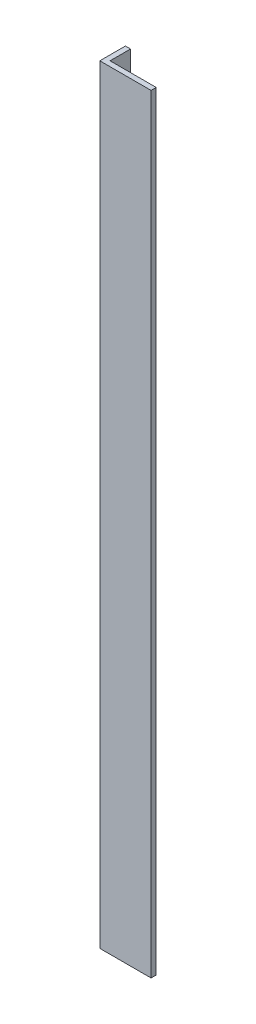
from build123d import *

# Parameters (mm, degrees)
BOSS_EXTRUDE1_DEPTH               = 300
F_3_0MM_DOWEL_HOLE1_D             = 3
F_3_0MM_DOWEL_HOLE2_D             = 3
SKETCH9_W                         = 1.5
SKETCH9_H                         = 1.999985051
F_3_0_3_DIAMETER_HOLE1_AT_2_COUNT = 2
F_3_0_3_DIAMETER_HOLE1_AT_2_PITCH = 24


with BuildPart() as part:
    # Sketch1 → Boss-Extrude1 (new body)
    with BuildSketch(Plane(origin=(0, 0, 0), x_dir=(1, 0, 0), z_dir=(0, 1, 0))):
        Polygon((0, 0), (0, 10), (2, 10), (2, 2), (20, 2), (20, 0), align=None)
    extrude(amount=BOSS_EXTRUDE1_DEPTH)

    # Ø3.0mm Dowel Hole1 (through all)
    with Locations(Plane.ZY):
        with Locations((-7.25, 2.75)):
            Hole(F_3_0MM_DOWEL_HOLE1_D / 2)

    # Ø3.0mm Dowel Hole2 (through all)
    with Locations(Plane.ZY):
        with Locations((-7.25, 211.25)):
            Hole(F_3_0MM_DOWEL_HOLE2_D / 2)

    # Sketch9 → Ø3.0 (3) Diameter Hole1 (revolve, cut)
    with BuildSketch(Plane(origin=(1.999985051, 288.000001132, -6.000000538), x_dir=(0, 0, -1), z_dir=(0, 1, 0))):
        with Locations((0.75, 0.999992526)):
            Rectangle(SKETCH9_W, SKETCH9_H)
    f_3_0_3_diameter_hole1 = revolve(axis=Axis((8.349985051, 288.000001132, -6.000000538), (-1, 0, 0)), mode=Mode.SUBTRACT)

    # Ø3.0 (3) Diameter Hole1 at 2: Ø3.0 (3) Diameter Hole1 ×2
    with Locations(*[(0, -i * F_3_0_3_DIAMETER_HOLE1_AT_2_PITCH, 0) for i in range(1, F_3_0_3_DIAMETER_HOLE1_AT_2_COUNT)]):
        add(f_3_0_3_diameter_hole1, mode=Mode.SUBTRACT)


solid = part.part
